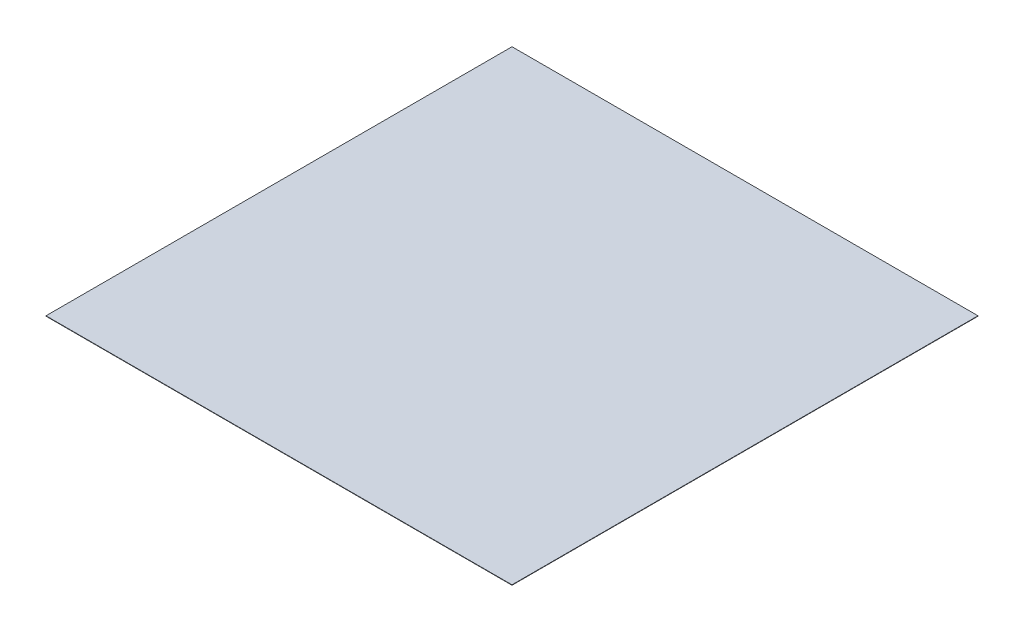
from build123d import *

# Parameters (mm, degrees)
BOSS_EXTRUDE1_DEPTH = 20
BOSS_EXTRUDE2_START = -5
SKETCH3_W           = 26.197224363
SKETCH3_H           = 40
SKETCH3_R           = 1.5
SKETCH3_W_2         = 30.197224362
BOSS_EXTRUDE2_DEPTH = 5
SKETCH4_W           = 1200
SKETCH4_H           = 1200
BOSS_EXTRUDE3_DEPTH = 1


with BuildPart() as part:
    # Sketch2 → Boss-Extrude1 (new body)
    with BuildSketch(Plane(origin=(0, 0, 134.88320255), x_dir=(-1, 0, 0), z_dir=(0, 0, -1))):
        with BuildLine():
            Line((-8.010113394, 153.56443927), (-27.207337757, 153.56443927))
            ThreePointArc((-27.207337757, 153.56443927), (-25.963827563, 152.287849446), (-25.510113394, 150.56443927))
            Line((-25.510113394, 150.56443927), (-25.510113394, 146.56443927))
            ThreePointArc((-25.510113394, 146.56443927), (-24.777880347, 144.796672317), (-23.010113394, 144.06443927))
            Line((-23.010113394, 144.06443927), (-19.010113394, 144.06443927))
            ThreePointArc((-19.010113394, 144.06443927), (-16.53523966, 143.039313005), (-15.510113394, 140.56443927))
            Line((-15.510113394, 140.56443927), (-15.510113394, 106.56443927))
            ThreePointArc((-15.510113394, 106.56443927), (-16.53523966, 104.089565536), (-19.010113394, 103.06443927))
            Line((-19.010113394, 103.06443927), (-23.010113394, 103.06443927))
            ThreePointArc((-23.010113394, 103.06443927), (-24.777880347, 102.332206223), (-25.510113394, 100.56443927))
            Line((-25.510113394, 100.56443927), (-25.510113394, 96.56443927))
            ThreePointArc((-25.510113394, 96.56443927), (-26.53523966, 94.089565536), (-29.010113394, 93.06443927))
            Line((-29.010113394, 93.06443927), (-63.010113394, 93.06443927))
            ThreePointArc((-63.010113394, 93.06443927), (-65.484987129, 94.089565536), (-66.510113394, 96.56443927))
            Line((-66.510113394, 96.56443927), (-66.510113394, 100.56443927))
            ThreePointArc((-66.510113394, 100.56443927), (-67.242346441, 102.332206223), (-69.010113394, 103.06443927))
            Line((-69.010113394, 103.06443927), (-73.010113394, 103.06443927))
            ThreePointArc((-73.010113394, 103.06443927), (-75.484987129, 104.089565536), (-76.510113394, 106.56443927))
            Line((-76.510113394, 106.56443927), (-76.510113394, 140.56443927))
            ThreePointArc((-76.510113394, 140.56443927), (-75.484987129, 143.039313005), (-73.010113394, 144.06443927))
            Line((-73.010113394, 144.06443927), (-69.010113394, 144.06443927))
            ThreePointArc((-69.010113394, 144.06443927), (-67.242346441, 144.796672317), (-66.510113394, 146.56443927))
            Line((-66.510113394, 146.56443927), (-66.510113394, 150.56443927))
            ThreePointArc((-66.510113394, 150.56443927), (-66.056399226, 152.287849446), (-64.812889032, 153.56443927))
            Line((-64.812889032, 153.56443927), (-84.010113394, 153.56443927))
            Line((-84.010113394, 153.56443927), (-84.010113394, 140.56443927))
            Line((-84.010113394, 140.56443927), (-84.010113394, 106.56443927))
            ThreePointArc((-84.010113394, 106.56443927), (-81.119985899, 99.13275252), (-73.968301038, 95.606251627))
            ThreePointArc((-73.968301038, 95.606251627), (-70.441800145, 88.454566766), (-63.010113394, 85.56443927))
            Line((-63.010113394, 85.56443927), (-29.010113394, 85.56443927))
            ThreePointArc((-29.010113394, 85.56443927), (-21.578426644, 88.454566766), (-18.051925751, 95.606251627))
            ThreePointArc((-18.051925751, 95.606251627), (-10.90024089, 99.13275252), (-8.010113394, 106.56443927))
            Line((-8.010113394, 106.56443927), (-8.010113394, 140.56443927))
            Line((-8.010113394, 140.56443927), (-8.010113394, 153.56443927))
        make_face()
    extrude(amount=BOSS_EXTRUDE1_DEPTH)

    # Sketch3 → Boss-Extrude2 (add)
    # profile 1 of 2: a face of its own
    with BuildSketch(Plane(origin=(0, 153.56443927, 0), x_dir=(1, 0, 0), z_dir=(0, 1, 0)).offset(BOSS_EXTRUDE2_START)):
        with Locations((11.108725576, -124.88320255)):
            Rectangle(SKETCH3_W, SKETCH3_H)
        with Locations(Location((3.010113394, -139.88320255, 0), (0, 0, 270))):
            Circle(SKETCH3_R, mode=Mode.SUBTRACT)
        with Locations(Location((3.010113394, -109.88320255, 0), (0, 0, 90))):
            Circle(SKETCH3_R, mode=Mode.SUBTRACT)
    # profile 2 of 2: a face of its own
    with BuildSketch(Plane(origin=(0, 153.56443927, 0), x_dir=(1, 0, 0), z_dir=(0, 1, 0)).offset(BOSS_EXTRUDE2_START)):
        with Locations((82.911501213, -124.88320255)):
            Rectangle(SKETCH3_W_2, SKETCH3_H)
        with Locations(Location((93.010113394, -109.88320255, 0), (0, 0, 270))):
            Circle(SKETCH3_R, mode=Mode.SUBTRACT)
        with Locations(Location((93.010113394, -139.88320255, 0), (0, 0, 90))):
            Circle(SKETCH3_R, mode=Mode.SUBTRACT)
    extrude(amount=BOSS_EXTRUDE2_DEPTH)


with BuildPart() as body_2:
    # Sketch4 → Boss-Extrude3 (new body)
    with BuildSketch(Plane(origin=(0, 201.76443927, 0), x_dir=(1, 0, 0), z_dir=(0, 1, 0))):
        Rectangle(SKETCH4_W, SKETCH4_H)
    extrude(amount=BOSS_EXTRUDE3_DEPTH)


solid = Compound([part.part, body_2.part])
